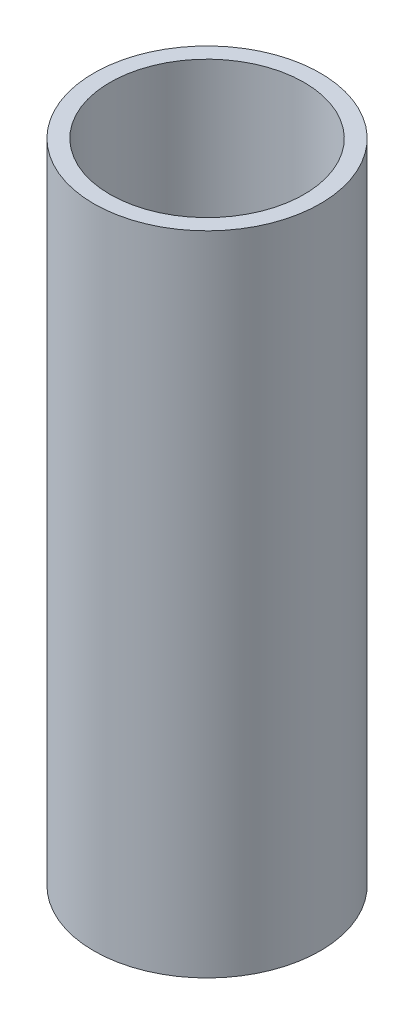
from build123d import *

# Parameters (mm, degrees)
SKETCH1_R           = 1.75
SKETCH1_R_2         = 1.5
BOSS_EXTRUDE1_DEPTH = 10


with BuildPart() as part:
    # Sketch1 → Boss-Extrude1 (new body)
    with BuildSketch(Plane(origin=(0, 0, 0), x_dir=(1, 0, 0), z_dir=(0, 1, 0))):
        with Locations(Location((0, 0, 0), (0, 0, 270))):
            Circle(SKETCH1_R)
        with Locations(Location((0, 0, 0), (0, 0, 270))):
            Circle(SKETCH1_R_2, mode=Mode.SUBTRACT)
    extrude(amount=BOSS_EXTRUDE1_DEPTH)


solid = part.part
